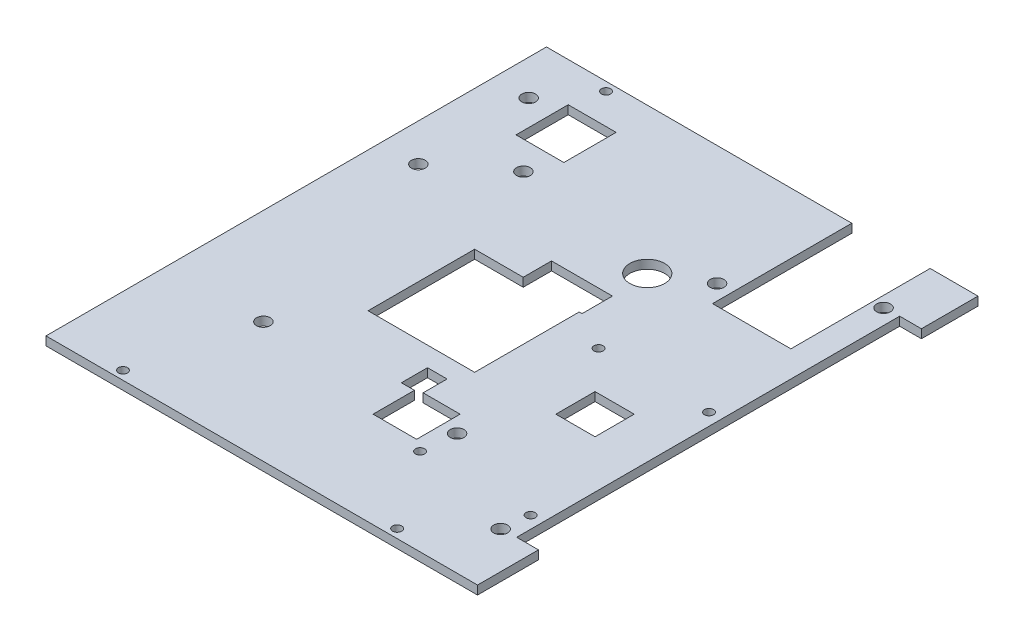
from build123d import *

# Parameters (mm, degrees)
SKETCH_1_R      = 1.05
SKETCH_1_R_2    = 1.585
SKETCH_1_W      = 9
SKETCH_1_H      = 9
SKETCH_1_W_2    = 11
SKETCH_1_H_2    = 12
SKETCH_1_R_3    = 4
EXTRUDE_1_DEPTH = 2


with BuildPart() as part:
    # 草图1 → 凸台-拉伸1 (new body)
    with BuildSketch(Plane(origin=(0, 0, 0), x_dir=(1, 0, 0), z_dir=(0, 1, 0))):
        Polygon((70.16, 0), (0, 0), (0, -115), (99.16, -115), (99.16, -101), (94.16, -101), (94.16, -13), (99.16, -13), (99.16, 0), (88.16, 0), (88.16, -32), (70.16, -32), align=None)
        with Locations(Location((15.69, -113, 0), (0, 0, 270))):
            Circle(SKETCH_1_R, mode=Mode.SUBTRACT)
        with Locations(Location((22.16, -87.2, 0), (0, 0, 270))):
            Circle(SKETCH_1_R_2, mode=Mode.SUBTRACT)
        Polygon((43.16, -48.5), (43.16, -42), (57.16, -42), (57.16, -49), (56.5, -49), (56.5, -73), (32, -73), (32, -48.5), align=None, mode=Mode.SUBTRACT)
        with Locations(Location((65.96, -95, 0), (0, 0, 270))):
            Circle(SKETCH_1_R, mode=Mode.SUBTRACT)
        with Locations(Location((66.66, -87.2, 0), (0, 0, 270))):
            Circle(SKETCH_1_R_2, mode=Mode.SUBTRACT)
        with Locations(Location((78.69, -113, 0), (0, 0, 270))):
            Circle(SKETCH_1_R, mode=Mode.SUBTRACT)
        with Locations(Location((90.66, -101.2, 0), (0, 0, 270))):
            Circle(SKETCH_1_R_2, mode=Mode.SUBTRACT)
        with Locations(Location((91.36, -95, 0), (0, 0, 270))):
            Circle(SKETCH_1_R, mode=Mode.SUBTRACT)
        Polygon((50.16, -83.5), (50.16, -77.5), (54.66, -77.5), (54.66, -83), (63.16, -83), (63.16, -93), (53.16, -93), (53.16, -83.5), align=None, mode=Mode.SUBTRACT)
        with Locations((78.66, -67.5)):
            Rectangle(SKETCH_1_W, SKETCH_1_H, mode=Mode.SUBTRACT)
        with Locations(Location((22.16, -27.46, 0), (0, 0, 270))):
            Circle(SKETCH_1_R_2, mode=Mode.SUBTRACT)
        with Locations((19.5, -15)):
            Rectangle(SKETCH_1_W_2, SKETCH_1_H_2, mode=Mode.SUBTRACT)
        with Locations(Location((15.69, -2, 0), (0, 0, 270))):
            Circle(SKETCH_1_R, mode=Mode.SUBTRACT)
        with Locations(Location((65.96, -54, 0), (0, 0, 270))):
            Circle(SKETCH_1_R, mode=Mode.SUBTRACT)
        with Locations(Location((56.66, -33.5, 0), (0, 0, 270))):
            Circle(SKETCH_1_R_3, mode=Mode.SUBTRACT)
        with Locations(Location((91.36, -54, 0), (0, 0, 270))):
            Circle(SKETCH_1_R, mode=Mode.SUBTRACT)
        with Locations(Location((66.66, -27.46, 0), (0, 0, 270))):
            Circle(SKETCH_1_R_2, mode=Mode.SUBTRACT)
        with Locations(Location((90.66, -13.2, 0), (0, 0, 270))):
            Circle(SKETCH_1_R_2, mode=Mode.SUBTRACT)
        with Locations(Location((8.12, -12.2, 0), (0, 0, 270))):
            Circle(SKETCH_1_R_2, mode=Mode.SUBTRACT)
        with Locations(Location((8.62, -38.06, 0), (0, 0, 270))):
            Circle(SKETCH_1_R_2, mode=Mode.SUBTRACT)
    extrude(amount=EXTRUDE_1_DEPTH)


solid = part.part
